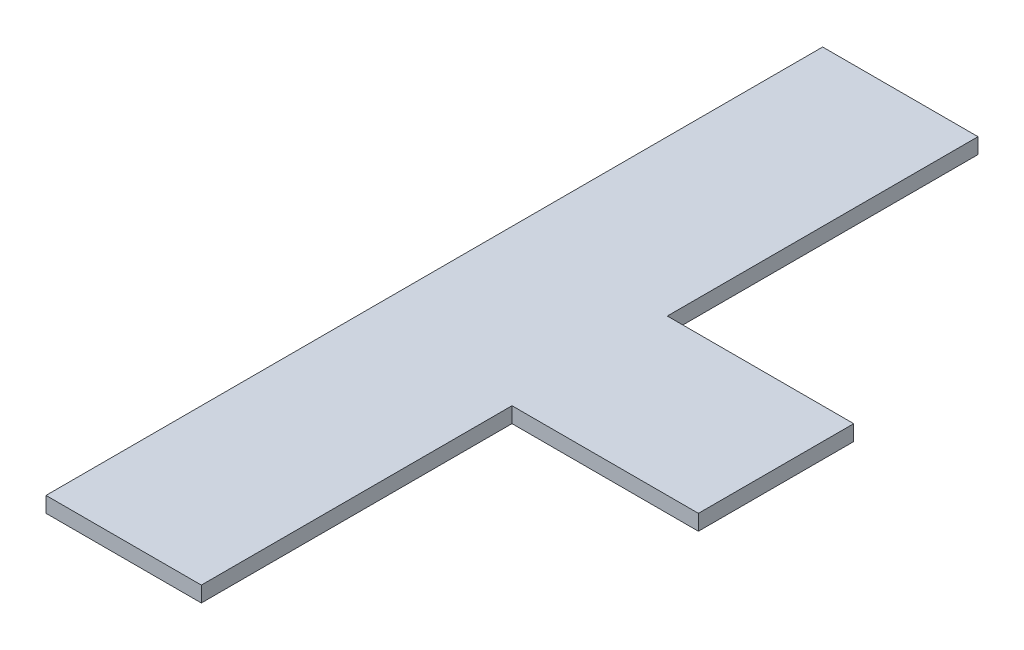
from build123d import *

# Parameters (mm, degrees)
SKETCH1_W           = 10
SKETCH1_H           = 50
SKETCH1_W_2         = 12
SKETCH1_H_2         = 10
BOSS_EXTRUDE1_DEPTH = 1


with BuildPart() as part:
    # Sketch1 → Boss-Extrude1 (new body)
    with BuildSketch(Plane(origin=(0, 0, 0), x_dir=(1, 0, 0), z_dir=(0, 1, 0))):
        with Locations((5, -25)):
            Rectangle(SKETCH1_W, SKETCH1_H)
        with Locations((16, -25)):
            Rectangle(SKETCH1_W_2, SKETCH1_H_2)
    extrude(amount=BOSS_EXTRUDE1_DEPTH)


solid = part.part
